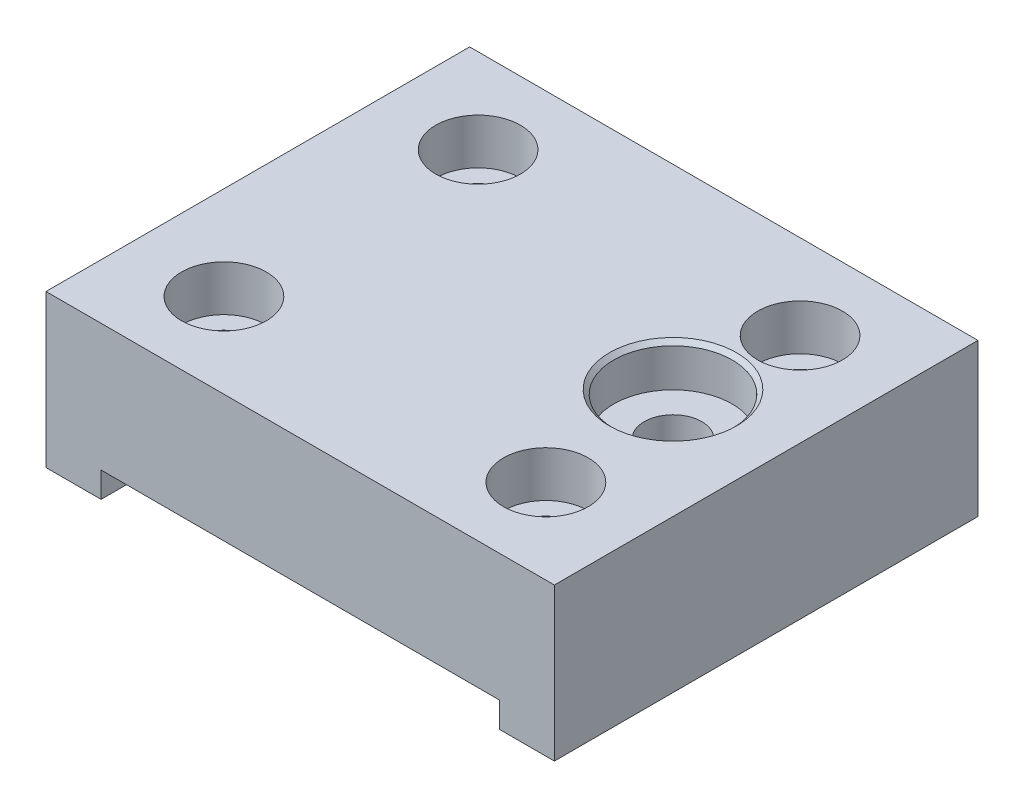
from build123d import *

# Parameters (mm, degrees)
SKETCH1_W                                           = 60
SKETCH1_H                                           = 50
BOSS_EXTRUDE1_DEPTH                                 = 9
SKETCH2_W                                           = 47
SKETCH2_H                                           = 6
CUT_EXTRUDE1_DEPTH                                  = 60
CBORE_FOR_M5_HEX_SOCKET_HEAD_CAP_SCREW1_D           = 5.5
CBORE_FOR_M5_HEX_SOCKET_HEAD_CAP_SCREW1_CBORE_D     = 10
CBORE_FOR_M5_HEX_SOCKET_HEAD_CAP_SCREW1_CBORE_DEPTH = 5.4
M8_TAPPED_HOLE1_D                                   = 6.8
SKETCH9_R                                           = 7
CUT_EXTRUDE2_DEPTH                                  = 5
CHAMFER1_SIZE                                       = 0.5


with BuildPart() as part:
    # Sketch1 → Boss-Extrude1 (new, symmetric)
    with BuildSketch(Plane(origin=(0, 0, 0), x_dir=(1, 0, 0), z_dir=(0, 1, 0))):
        Rectangle(SKETCH1_W, SKETCH1_H)
    extrude(amount=BOSS_EXTRUDE1_DEPTH, both=True)

    # Sketch2 → Cut-Extrude1 (cut, through all)
    with BuildSketch(Plane.XY.offset(25)):
        with Locations((0, -9)):
            Rectangle(SKETCH2_W, SKETCH2_H)
    extrude(amount=-CUT_EXTRUDE1_DEPTH, mode=Mode.SUBTRACT)

    # CBORE for M5 Hex Socket Head Cap Screw1 (through all)
    with Locations(Plane(origin=(0, 9, 0), x_dir=(1, 0, 0), z_dir=(0, 1, 0))):
        with Locations((-19, 15), (19, 15), (19, -15), (-19, -15)):
            CounterBoreHole(CBORE_FOR_M5_HEX_SOCKET_HEAD_CAP_SCREW1_D / 2, CBORE_FOR_M5_HEX_SOCKET_HEAD_CAP_SCREW1_CBORE_D / 2, CBORE_FOR_M5_HEX_SOCKET_HEAD_CAP_SCREW1_CBORE_DEPTH)

    # M8 Tapped Hole1 (through all)
    with Locations(Plane(origin=(0, 9, 0), x_dir=(1, 0, 0), z_dir=(0, 1, 0))):
        with Locations((17, 2)):
            Hole(M8_TAPPED_HOLE1_D / 2)

    # Sketch9 → Cut-Extrude2 (cut)
    with BuildSketch(Plane(origin=(0, 9, 0), x_dir=(1, 0, 0), z_dir=(0, 1, 0))):
        with Locations(Location((17, 2, 0), (0, 0, 270))):
            Circle(SKETCH9_R)
    extrude(amount=-CUT_EXTRUDE2_DEPTH, mode=Mode.SUBTRACT)

    # Chamfer1
    chamfer1_edges = [part.edges().sort_by_distance(p)[0] for p in [
        (17, 9, -9),
    ]]
    chamfer(chamfer1_edges, length=CHAMFER1_SIZE)


solid = part.part
